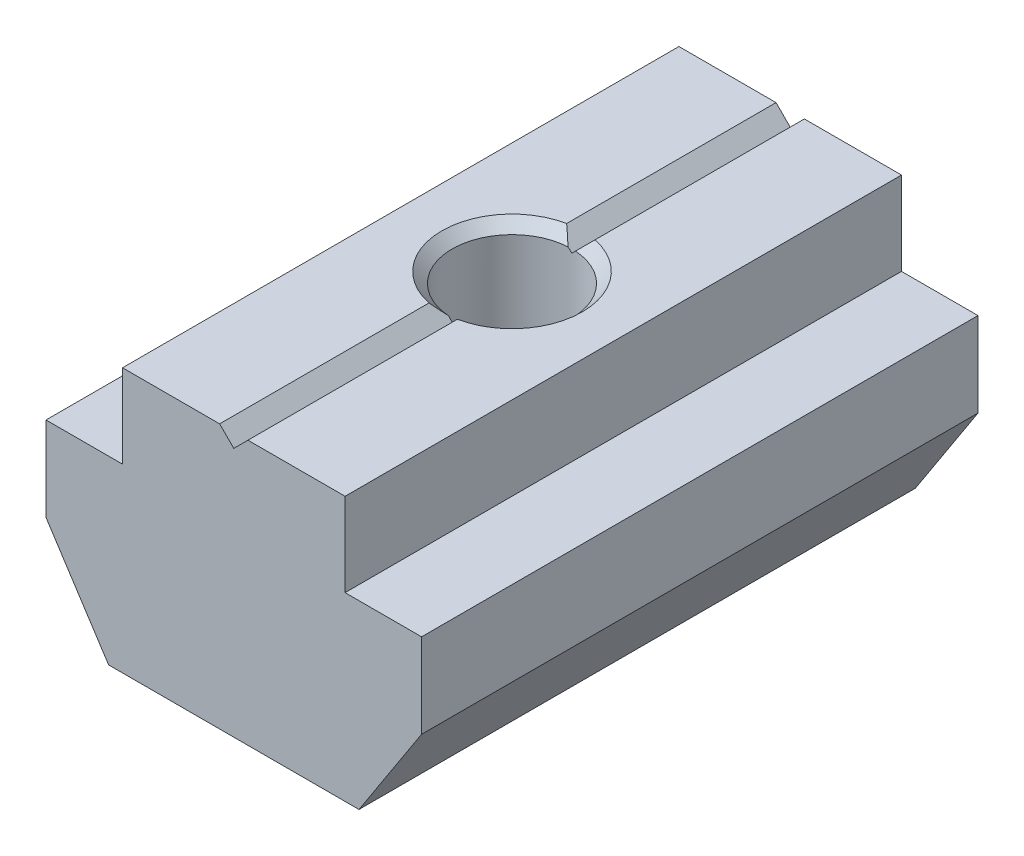
from build123d import *

# Parameters (mm, degrees)
EXTRUDE_1_DEPTH     = 10
SKETCH_2_R          = 2.15
CUT_EXTRUDE_1_DEPTH = 16.356187678
CUT_EXTRUDE_2_DEPTH = 10
CHAMFER_1_SIZE      = 0.375


with BuildPart() as part:
    # 草图1 → 凸台-拉伸1 (new, symmetric)
    with BuildSketch(Plane.XY):
        Polygon((-4.5, 0), (4.5, 0), (6.75, 3.464696169), (6.75, 6.5), (4, 6.5), (4, 9.5), (-4, 9.5), (-4, 6.5), (-6.75, 6.5), (-6.75, 3.464696169), align=None)
    extrude(amount=EXTRUDE_1_DEPTH, both=True)

    # 草图2 → 切除-拉伸1 (cut, through all)
    with BuildSketch(Plane(origin=(0, 9.5, 0), x_dir=(1, 0, 0), z_dir=(0, 1, 0))):
        with Locations(Location((0, 0, 0), (0, 0, 180))):
            Circle(SKETCH_2_R)
    extrude(amount=-CUT_EXTRUDE_1_DEPTH, mode=Mode.SUBTRACT)

    # 草图3 → 切除-拉伸2 (cut, symmetric)
    with BuildSketch(Plane.XY):
        Polygon((-0.509116882, 9.5), (0, 8.990883118), (0.509116882, 9.5), (0, 10.009116882), align=None)
    extrude(amount=CUT_EXTRUDE_2_DEPTH, both=True, mode=Mode.SUBTRACT)

    # 倒角1
    chamfer_1_edges = [part.edges().sort_by_distance(p)[0] for p in [
        (2.15, 0, 0),
        (2.15, 9.5, 0),
        (-1.690724889, 9.5, -1.32813755),
    ]]
    chamfer(chamfer_1_edges, length=CHAMFER_1_SIZE)


solid = part.part
